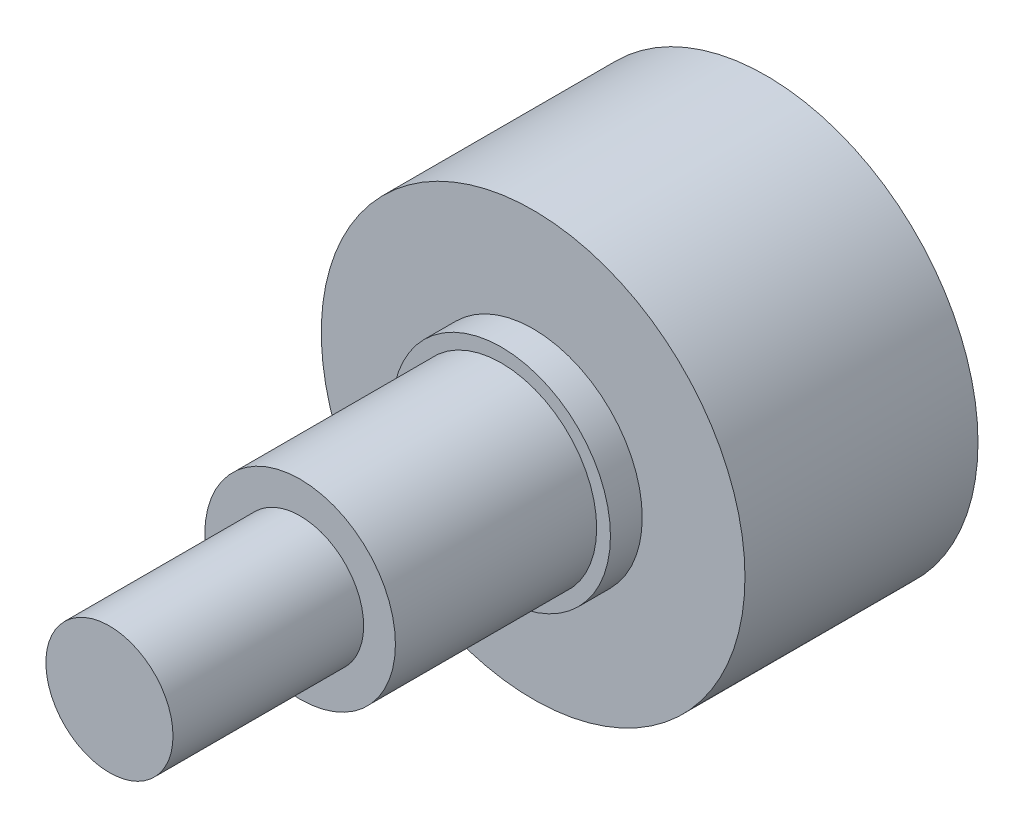
from build123d import *

# Parameters (mm, degrees)
SKETCH1_R           = 10
BOSS_EXTRUDE1_DEPTH = 11
SKETCH2_R           = 5.15
BOSS_EXTRUDE2_DEPTH = 1.5
SKETCH3_R           = 4.5
BOSS_EXTRUDE3_DEPTH = 9.5
SKETCH4_R           = 3
BOSS_EXTRUDE4_DEPTH = 9


with BuildPart() as part:
    # Sketch1 → Boss-Extrude1 (new body)
    with BuildSketch(Plane.XY):
        Circle(SKETCH1_R)
    extrude(amount=BOSS_EXTRUDE1_DEPTH)

    # Sketch2 → Boss-Extrude2 (add)
    with BuildSketch(Plane.XY.offset(11)):
        Circle(SKETCH2_R)
    extrude(amount=BOSS_EXTRUDE2_DEPTH)

    # Sketch3 → Boss-Extrude3 (add)
    with BuildSketch(Plane.XY.offset(12.5)):
        Circle(SKETCH3_R)
    extrude(amount=BOSS_EXTRUDE3_DEPTH)

    # Sketch4 → Boss-Extrude4 (add)
    with BuildSketch(Plane.XY.offset(22)):
        Circle(SKETCH4_R)
    extrude(amount=BOSS_EXTRUDE4_DEPTH)


solid = part.part
